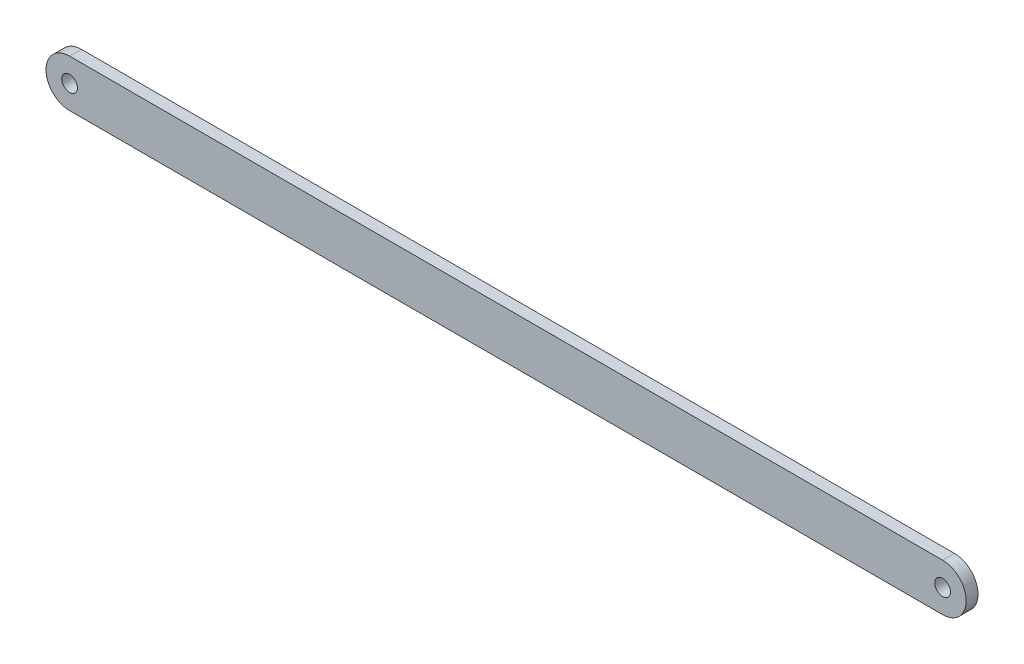
from build123d import *

# Parameters (mm, degrees)
SKETCH1_R           = 2
BOSS_EXTRUDE3_DEPTH = 3


with BuildPart() as part:
    # Sketch1 → Boss-Extrude3 (new body)
    with BuildSketch(Plane.XY):
        with BuildLine():
            Line((-35.312724167, 6), (186.687275833, 6))
            ThreePointArc((186.687275833, 6), (192.687275833, 0), (186.687275833, -6))
            Line((186.687275833, -6), (-35.312724167, -6))
            ThreePointArc((-35.312724167, -6), (-41.312724167, 0), (-35.312724167, 6))
        make_face()
        with Locations((-35.312724167, 0)):
            Circle(SKETCH1_R, mode=Mode.SUBTRACT)
        with Locations((186.687275833, 0)):
            Circle(SKETCH1_R, mode=Mode.SUBTRACT)
    extrude(amount=BOSS_EXTRUDE3_DEPTH)


solid = part.part
